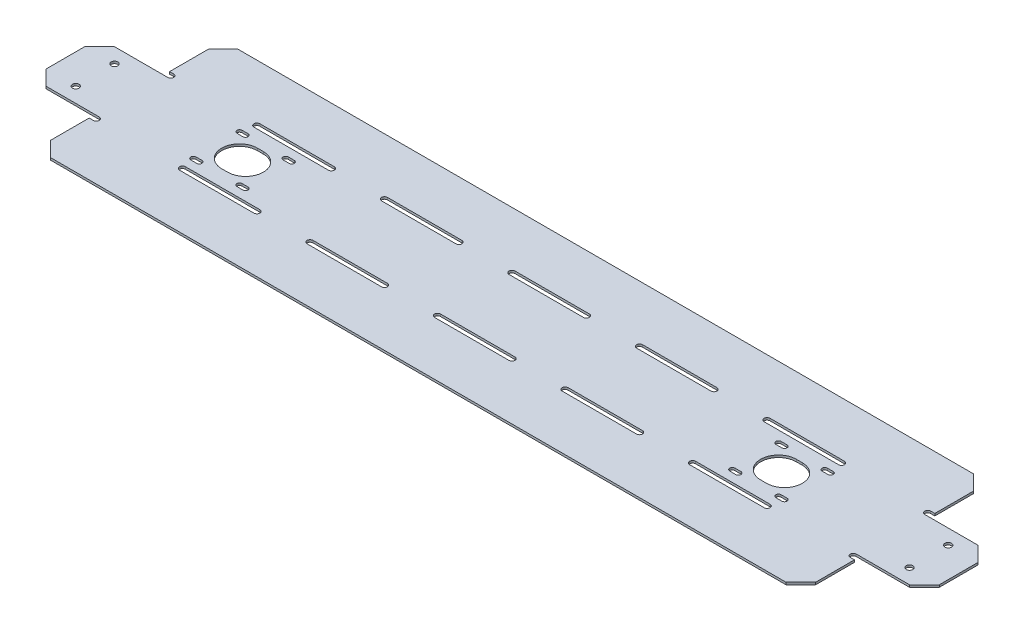
from build123d import *

# Parameters (mm, degrees)
BOSS_EXTRUDE1_DEPTH = 1.5
CUT_EXTRUDE2_DEPTH  = 3
SKETCH4_R           = 2.25
CUT_EXTRUDE3_DEPTH  = 10
CHAMFER3_SIZE       = 10
CHAMFER4_SIZE       = 10


with BuildPart() as part:
    # Sketch1 → Boss-Extrude1 (new body)
    with BuildSketch(Plane(origin=(0, 0, 0), x_dir=(1, 0, 0), z_dir=(0, 1, 0))):
        with BuildLine():
            Line((300, 2), (300, 48))
            Line((300, 48), (275, 48))
            ThreePointArc((275, 48), (273, 50), (275, 52))
            Line((275, 52), (300, 52))
            Line((300, 52), (300, 88))
            Line((300, 88), (43, 88))
            Line((43, 88), (43, 52))
            Line((43, 52), (45.783630632, 52))
            ThreePointArc((45.783630632, 52), (47.783630632, 50), (45.783630632, 48))
            Line((45.783630632, 48), (43, 48))
            Line((43, 48), (0, 48))
            Line((0, 48), (0, 2))
            Line((0, 2), (43, 2))
            Line((43, 2), (45.783630632, 2))
            ThreePointArc((45.783630632, 2), (47.783630632, 0), (45.783630632, -2))
            Line((45.783630632, -2), (43, -2))
            Line((43, -2), (43, -38))
            Line((43, -38), (300, -38))
            Line((300, -38), (300, -2))
            Line((300, -2), (275, -2))
            ThreePointArc((275, -2), (273, 0), (275, 2))
            Line((275, 2), (300, 2))
        make_face()
        with BuildLine():
            Line((103.666666667, 2), (153.666666667, 2))
            ThreePointArc((153.666666667, 2), (155.666666667, 0), (153.666666667, -2))
            Line((153.666666667, -2), (103.666666667, -2))
            ThreePointArc((103.666666667, -2), (101.666666667, 0), (103.666666667, 2))
        make_face(mode=Mode.SUBTRACT)
        with BuildLine():
            Line((189.333333333, 2), (239.333333333, 2))
            ThreePointArc((239.333333333, 2), (241.333333333, 0), (239.333333333, -2))
            Line((239.333333333, -2), (189.333333333, -2))
            ThreePointArc((189.333333333, -2), (187.333333333, 0), (189.333333333, 2))
        make_face(mode=Mode.SUBTRACT)
        with BuildLine():
            Line((189.333333333, 48), (239.333333333, 48))
            ThreePointArc((239.333333333, 48), (241.333333333, 50), (239.333333333, 52))
            Line((239.333333333, 52), (189.333333333, 52))
            ThreePointArc((189.333333333, 52), (187.333333333, 50), (189.333333333, 48))
        make_face(mode=Mode.SUBTRACT)
        with BuildLine():
            Line((103.666666667, 48), (153.666666667, 48))
            ThreePointArc((153.666666667, 48), (155.666666667, 50), (153.666666667, 52))
            Line((153.666666667, 52), (103.666666667, 52))
            ThreePointArc((103.666666667, 52), (101.666666667, 50), (103.666666667, 48))
        make_face(mode=Mode.SUBTRACT)
    extrude(amount=BOSS_EXTRUDE1_DEPTH)

    # Sketch3 → Cut-Extrude2 (cut)
    with BuildSketch(Plane(origin=(0, 1.5, 0), x_dir=(1, 0, 0), z_dir=(0, 1, 0))):
        with BuildLine():
            Line((117, 37), (121, 37))
            ThreePointArc((121, 37), (133, 25), (121, 13))
            Line((121, 13), (117, 13))
            ThreePointArc((117, 13), (105, 25), (117, 37))
        make_face()
        with BuildLine():
            Line((101.5, 11.25), (105.5, 11.25))
            ThreePointArc((105.5, 11.25), (107.25, 9.5), (105.5, 7.75))
            Line((105.5, 7.75), (101.5, 7.75))
            ThreePointArc((101.5, 7.75), (99.75, 9.5), (101.5, 11.25))
        make_face()
        with BuildLine():
            Line((136.5, 7.75), (132.5, 7.75))
            ThreePointArc((132.5, 7.75), (130.75, 9.5), (132.5, 11.25))
            Line((132.5, 11.25), (136.5, 11.25))
            ThreePointArc((136.5, 11.25), (138.25, 9.5), (136.5, 7.75))
        make_face()
        with BuildLine():
            Line((132.5, 42.25), (136.5, 42.25))
            ThreePointArc((136.5, 42.25), (138.25, 40.5), (136.5, 38.75))
            Line((136.5, 38.75), (132.5, 38.75))
            ThreePointArc((132.5, 38.75), (130.75, 40.5), (132.5, 42.25))
        make_face()
        with BuildLine():
            Line((105.5, 38.75), (101.5, 38.75))
            ThreePointArc((101.5, 38.75), (99.75, 40.5), (101.5, 42.25))
            Line((101.5, 42.25), (105.5, 42.25))
            ThreePointArc((105.5, 42.25), (107.25, 40.5), (105.5, 38.75))
        make_face()
    extrude(amount=-CUT_EXTRUDE2_DEPTH, mode=Mode.SUBTRACT)

    # Mirror3: part across plane


with BuildPart() as part_1:
    add(part.part)
    add(part.part.mirror(Plane(origin=(300, 0, 0), x_dir=(0, 0, 1), z_dir=(1, 0, 0))))

    # Sketch4 → Cut-Extrude3 (cut)
    with BuildSketch(Plane(origin=(0, 1.5, 0), x_dir=(1, 0, 0), z_dir=(0, 1, 0))):
        with Locations(Location((20, 38, 0), (0, 0, 270))):
            Circle(SKETCH4_R)
        with Locations(Location((20, 12, 0), (0, 0, 270))):
            Circle(SKETCH4_R)
    cut_extrude3 = extrude(amount=-CUT_EXTRUDE3_DEPTH, mode=Mode.SUBTRACT)

    # Mirror4: Cut-Extrude3 across plane
    add(cut_extrude3.mirror(Plane(origin=(300, 0, 0), x_dir=(0, 0, 1), z_dir=(1, 0, 0))), mode=Mode.SUBTRACT)

    # Chamfer3
    chamfer3_edges = [part_1.edges().sort_by_distance(p)[0] for p in [
        (43, 0.75, 38),
        (0, 0.75, -2),
        (0, 0.75, -48),
        (43, 0.75, -88),
    ]]
    chamfer(chamfer3_edges, length=CHAMFER3_SIZE)

    # Chamfer4
    chamfer4_edges = [part_1.edges().sort_by_distance(p)[0] for p in [
        (557, 0.75, -88),
        (600, 0.75, -48),
        (600, 0.75, -2),
        (557, 0.75, 38),
    ]]
    chamfer(chamfer4_edges, length=CHAMFER4_SIZE)


solid = part_1.part
